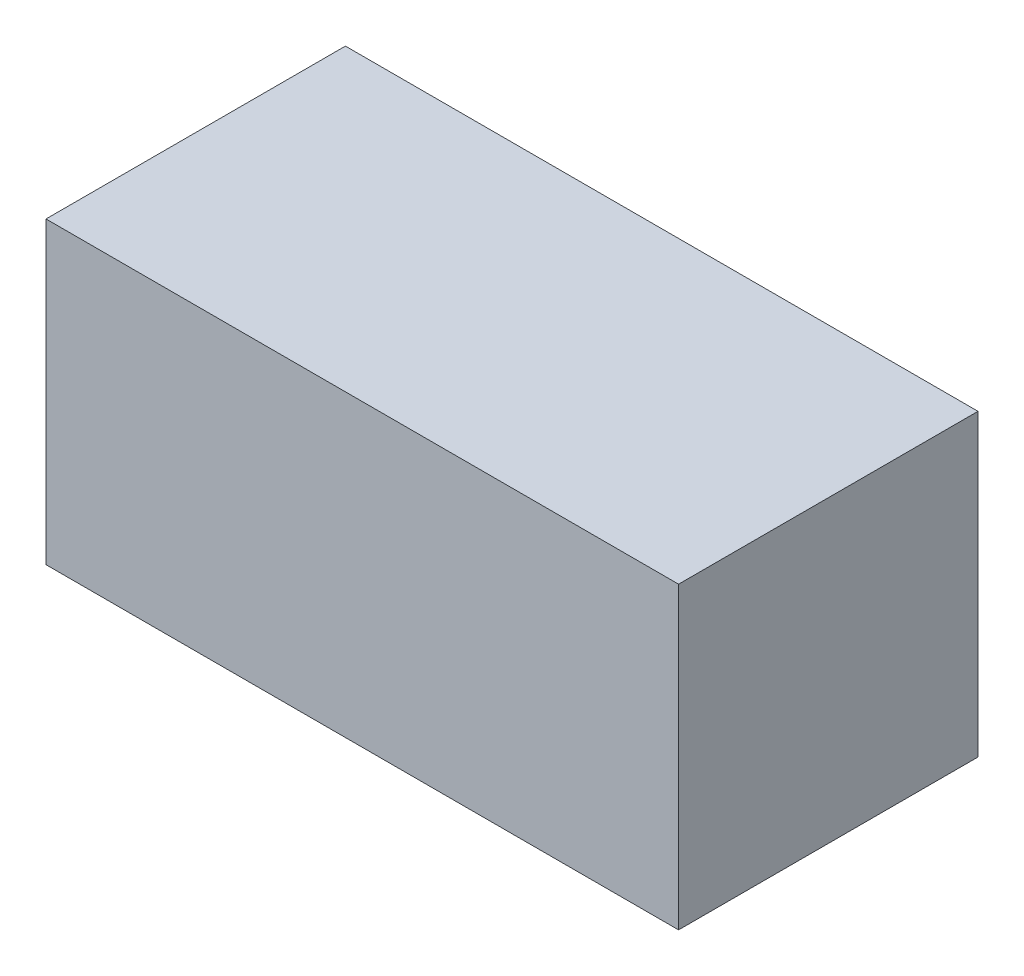
from build123d import *

# Parameters (mm, degrees)
SKETCH1_W           = 75
SKETCH1_H           = 35.5
BOSS_EXTRUDE1_DEPTH = 35.5


with BuildPart() as part:
    # Sketch1 → Boss-Extrude1 (new body)
    with BuildSketch(Plane.XY):
        Rectangle(SKETCH1_W, SKETCH1_H)
    extrude(amount=BOSS_EXTRUDE1_DEPTH)


solid = part.part
